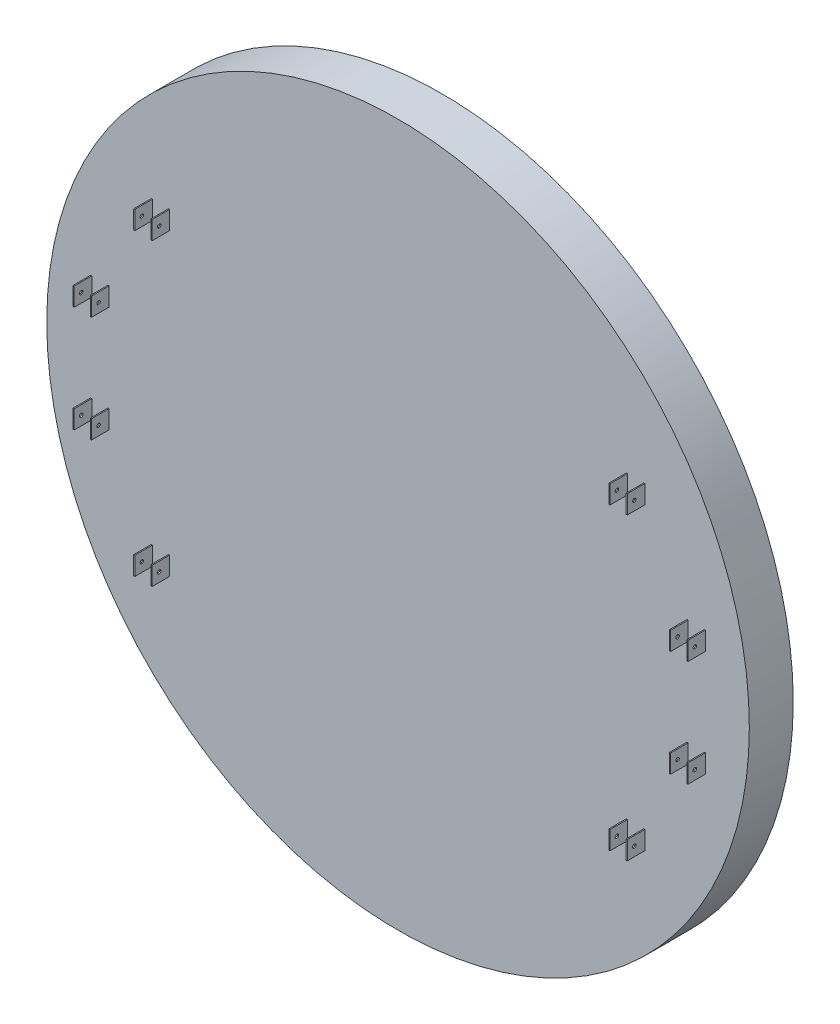
from build123d import *

# Parameters (mm, degrees)
SKETCH1_R               = 400
BOSS_EXTRUDE1_DEPTH     = 50
SKETCH2_W               = 21
SKETCH2_H               = 21
BOSS_EXTRUDE2_DEPTH     = 20
SKETCH4_W               = 18.5
SKETCH4_H               = 21
CUT_EXTRUDE1_DEPTH      = 20
CUT_EXTRUDE2_DEPTH      = 793.881453939
CUT_EXTRUDE2_DEPTH_BACK = 793.881453939
SKETCH5_R               = 2
SKETCH6_R               = 4.380137325
SKETCH6_R_2             = 5.425166138
SKETCH6_R_3             = 8.421376202
SKETCH6_R_4             = 2.814926411
SKETCH6_R_5             = 5.941885297
SKETCH6_R_6             = 3.197207439
SKETCH6_R_7             = 2.027882418
CUT_EXTRUDE3_DEPTH      = 10


with BuildPart() as part:
    # Sketch1 → Boss-Extrude1 (new body)
    with BuildSketch(Plane.XY):
        Circle(SKETCH1_R)
    extrude(amount=BOSS_EXTRUDE1_DEPTH)

    # Sketch2 → Boss-Extrude2 (add)
    with BuildSketch(Plane.XY.offset(50)):
        with Locations((339.5, -60.5)):
            Rectangle(SKETCH2_W, SKETCH2_H)
        with Locations((339.5, 60.5)):
            Rectangle(SKETCH2_W, SKETCH2_H)
        with Locations((270.5, -170.5)):
            Rectangle(SKETCH2_W, SKETCH2_H)
        with Locations((270.5, 170.5)):
            Rectangle(SKETCH2_W, SKETCH2_H)
        with Locations((-270.5, -170.5)):
            Rectangle(SKETCH2_W, SKETCH2_H)
        with Locations((-339.5, -60.5)):
            Rectangle(SKETCH2_W, SKETCH2_H)
        with Locations((-339.5, 60.5)):
            Rectangle(SKETCH2_W, SKETCH2_H)
        with Locations((-270.5, 170.5)):
            Rectangle(SKETCH2_W, SKETCH2_H)
    extrude(amount=BOSS_EXTRUDE2_DEPTH)

    # Sketch4 → Cut-Extrude1 (cut)
    with BuildSketch(Plane.XY.offset(70)):
        with Locations((270.5, 170.5)):
            Rectangle(SKETCH4_W, SKETCH4_H)
        with Locations((339.5, 60.5)):
            Rectangle(SKETCH4_W, SKETCH4_H)
        with Locations((339.5, -60.5)):
            Rectangle(SKETCH4_W, SKETCH4_H)
        with Locations((270.5, -170.5)):
            Rectangle(SKETCH4_W, SKETCH4_H)
        with Locations((-270.5, -170.5)):
            Rectangle(SKETCH4_W, SKETCH4_H)
        with Locations((-339.5, -60.5)):
            Rectangle(SKETCH4_W, SKETCH4_H)
        with Locations((-339.5, 60.5)):
            Rectangle(SKETCH4_W, SKETCH4_H)
        with Locations((-270.5, 170.5)):
            Rectangle(SKETCH4_W, SKETCH4_H)
    extrude(amount=-CUT_EXTRUDE1_DEPTH, mode=Mode.SUBTRACT)

    # Sketch5 → Cut-Extrude2 (cut, two sides: drawn at the far end of the back side and taken through both)
    with BuildSketch(Plane(origin=(281, 0, 0), x_dir=(0, 0, -1), z_dir=(1, 0, 0)).offset(-CUT_EXTRUDE2_DEPTH_BACK)):
        with Locations((-62, 170.5)):
            Circle(SKETCH5_R)
        with Locations((-62, 60.5)):
            Circle(SKETCH5_R)
        with Locations((-62, -60.5)):
            Circle(SKETCH5_R)
        with Locations((-62, -170.5)):
            Circle(SKETCH5_R)
    extrude(amount=CUT_EXTRUDE2_DEPTH + CUT_EXTRUDE2_DEPTH_BACK, mode=Mode.SUBTRACT)

    # Sketch6 → Cut-Extrude3 (cut)
    with BuildSketch(Plane(origin=(0, 0, 0), x_dir=(-1, 0, 0), z_dir=(0, 0, -1))):
        with Locations((298.667764573, -172.435914274)):
            Circle(SKETCH6_R)
        with Locations((0, 342.463612446)):
            Circle(SKETCH6_R_2)
        with Locations((-298.667764573, -172.435914274)):
            Circle(SKETCH6_R_3)
        with Locations((276.746350043, -159.779579694)):
            Circle(SKETCH6_R_4)
        with Locations((-276.746350043, -159.779579694)):
            Circle(SKETCH6_R_5)
        with Locations((0, 311.235670646)):
            Circle(SKETCH6_R_6)
        with Locations((263.641581449, -152.213538019)):
            Circle(SKETCH6_R_7)
    extrude(amount=-CUT_EXTRUDE3_DEPTH, mode=Mode.SUBTRACT)


solid = part.part
